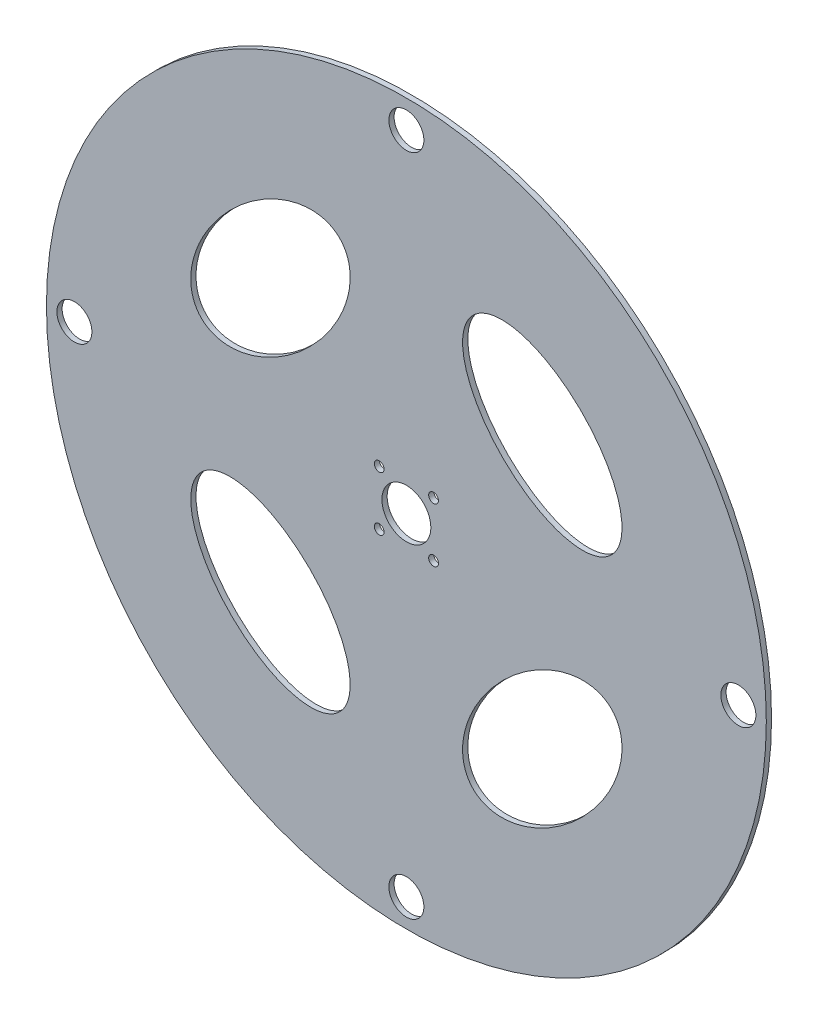
from build123d import *

# Parameters (mm, degrees)
SKETCH1_R                                      = 103
BASE_DISC_DEPTH                                = 1.5
SKETCH3_R                                      = 3
CUT_EXTRUDE1_DEPTH                             = 146.671719973
SKETCH4_RX                                     = 28
SKETCH4_RY                                     = 16
CUT_EXTRUDE2_DEPTH                             = 146.671719973
SKETCH2_R                                      = 7.5
CUT_EXTRUDE3_DEPTH                             = 146.671720116
CIRPATTERN3_COUNT                              = 4
CIRPATTERN4_COUNT                              = 4
SKETCH5_R                                      = 1.4
CUT_EXTRUDE4_DEPTH                             = 146.671720116
SKETCH6_R                                      = 7.51
SKETCH6_R_2                                    = 7
CENTRE_BORE_CORRECTION_D14_DEPTH               = 1.5
SKETCH7_R                                      = 5.01
REVB_FOUR_CARTRIDGE_PILOT_HOLES_D10P02_R_DEPTH = 146.671720116


with BuildPart() as part:
    # Sketch1 → Base Disc (new body)
    with BuildSketch(Plane.XY):
        Circle(SKETCH1_R)
    extrude(amount=BASE_DISC_DEPTH)

    # Sketch3 → Cut-Extrude1 (cut, through all)
    with BuildSketch(Plane(origin=(0, 0, 0), x_dir=(-1, 0, 0), z_dir=(0, 0, -1))):
        with Locations((95, 0)):
            Circle(SKETCH3_R)
    cut_extrude1 = extrude(amount=-CUT_EXTRUDE1_DEPTH, mode=Mode.SUBTRACT)

    # Sketch4 → Cut-Extrude2 (cut, through all)
    with BuildSketch(Plane(origin=(0, 0, 0), x_dir=(-1, 0, 0), z_dir=(0, 0, -1))):
        with Locations(Location((38.890872965, 38.890872965), (0, 0, 135))):
            Ellipse(SKETCH4_RX, SKETCH4_RY)
    cut_extrude2 = extrude(amount=-CUT_EXTRUDE2_DEPTH, mode=Mode.SUBTRACT)

    # Sketch2 → Cut-Extrude3 (cut, through all)
    with BuildSketch(Plane(origin=(0, 0, 0), x_dir=(-1, 0, 0), z_dir=(0, 0, -1))):
        Circle(SKETCH2_R)
    extrude(amount=-CUT_EXTRUDE3_DEPTH, mode=Mode.SUBTRACT)

    # CirPattern3: Cut-Extrude1 ×4 about axis
    cirpattern3_axis = Axis((0, 0, 0), (0, 0, 1))
    for i in range(1, CIRPATTERN3_COUNT):
        add(cut_extrude1.rotate(cirpattern3_axis, i * 360 / CIRPATTERN3_COUNT), mode=Mode.SUBTRACT)

    # CirPattern4: Cut-Extrude2 ×4 about axis
    cirpattern4_axis = Axis((0, 0, 0), (0, 0, -1))
    for i in range(1, CIRPATTERN4_COUNT):
        add(cut_extrude2.rotate(cirpattern4_axis, i * 360 / CIRPATTERN4_COUNT), mode=Mode.SUBTRACT)

    # Sketch5 → Cut-Extrude4 (cut, through all)
    with BuildSketch(Plane.XY):
        with Locations((-7.778174593, -7.778174593)):
            Circle(SKETCH5_R)
        with Locations((-7.778174593, 7.778174593)):
            Circle(SKETCH5_R)
        with Locations((7.778174593, 7.778174593)):
            Circle(SKETCH5_R)
        with Locations((7.778174593, -7.778174593)):
            Circle(SKETCH5_R)
    extrude(amount=CUT_EXTRUDE4_DEPTH, mode=Mode.SUBTRACT)

    # Sketch6 → Centre_Bore_Correction_D14 (add)
    with BuildSketch(Plane.XY):
        Circle(SKETCH6_R)
        Circle(SKETCH6_R_2, mode=Mode.SUBTRACT)
    extrude(amount=CENTRE_BORE_CORRECTION_D14_DEPTH)

    # Sketch7 → RevB_Four_Cartridge_Pilot_Holes_D10p02_R95 (cut, through all)
    with BuildSketch(Plane(origin=(0, 0, 0), x_dir=(-1, 0, 0), z_dir=(0, 0, -1))):
        with Locations((-95, 0)):
            Circle(SKETCH7_R)
        with Locations((0, 95)):
            Circle(SKETCH7_R)
        with Locations((95, 0)):
            Circle(SKETCH7_R)
        with Locations((0, -95)):
            Circle(SKETCH7_R)
    extrude(amount=-REVB_FOUR_CARTRIDGE_PILOT_HOLES_D10P02_R_DEPTH, mode=Mode.SUBTRACT)


solid = part.part
